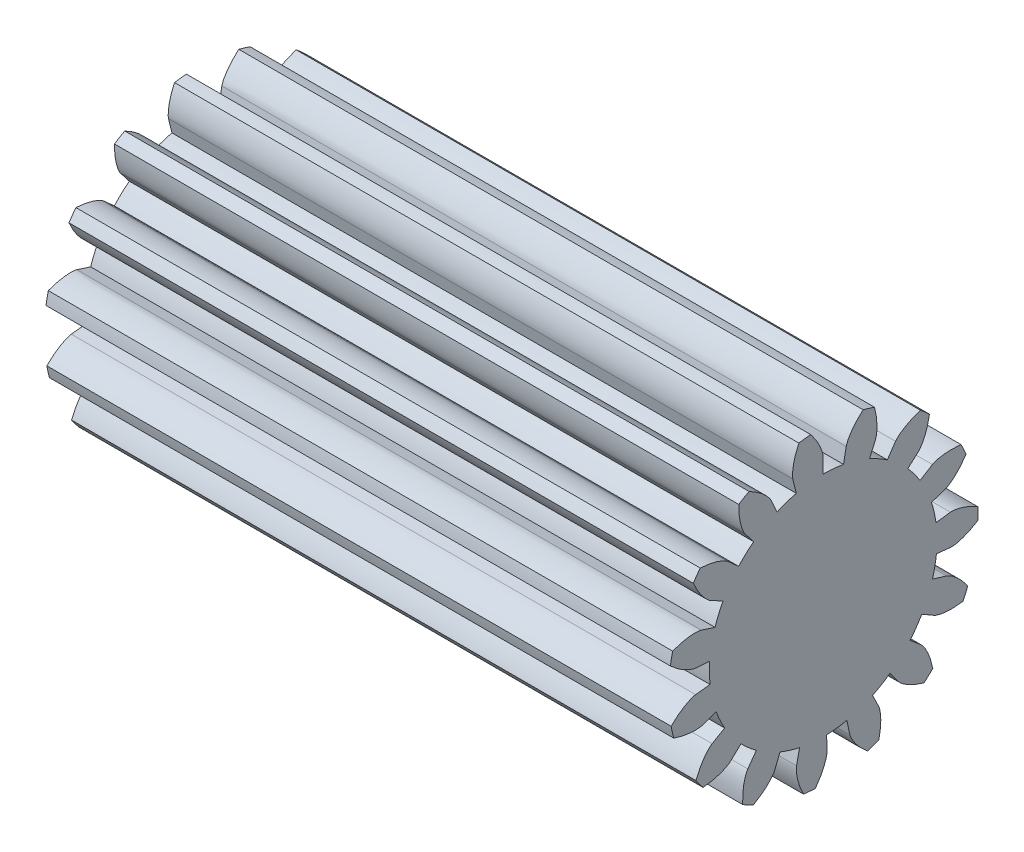
from build123d import *

# Parameters (mm, degrees)
SKETCH1_R                 = 2.833333333
BOSS_EXTRUDE1_DEPTH       = 11.43
CUT_EXTRUDE1_DEPTH        = 13.111996349
CIRPATTERN6_COUNT         = 15
CIRPATTERN6_COPY_1_DEPTH  = 13.111996349
CIRPATTERN6_COPY_2_DEPTH  = 13.111996349
CIRPATTERN6_COPY_3_DEPTH  = 13.111996349
CIRPATTERN6_COPY_4_DEPTH  = 13.111996349
CIRPATTERN6_COPY_5_DEPTH  = 13.111996349
CIRPATTERN6_COPY_6_DEPTH  = 13.111996349
CIRPATTERN6_COPY_7_DEPTH  = 13.111996349
CIRPATTERN6_COPY_8_DEPTH  = 13.111996349
CIRPATTERN6_COPY_9_DEPTH  = 13.111996349
CIRPATTERN6_COPY_10_DEPTH = 13.111996349
CIRPATTERN6_COPY_11_DEPTH = 13.111996349
CIRPATTERN6_COPY_12_DEPTH = 13.111996349
CIRPATTERN6_COPY_13_DEPTH = 13.111996349
CIRPATTERN6_COPY_14_DEPTH = 13.111996349


with BuildPart() as part:
    # Sketch1 → Boss-Extrude1 (new body)
    with BuildSketch(Plane.YZ):
        with Locations(Location((0, 0, 0), (0, 0, 270))):
            Circle(SKETCH1_R)
    extrude(amount=BOSS_EXTRUDE1_DEPTH)

    # Sketch3 → Cut-Extrude1 (cut, through all)
    with BuildSketch(Plane.YZ.offset(11.43)):
        with BuildLine():
            Line((2.489923292, -0.224236484), (2.339762544, -0.210713369))
            Line((2.339762544, -0.210713369), (2.074936077, -0.186863736))
            ThreePointArc((2.074936077, -0.186863736), (2.08123296, -0.093526159), (2.083333333, 0))
            Line((2.083333333, 0), (2.349231552, 0))
            add(Edge.make_bspline(
                [(2.349231552, 0), (2.350968346, 3.6754e-05), (2.355835834, 0.000253578), (2.370835553, 0.001656605), (2.400223443, 0.006481364), (2.436045096, 0.01536564), (2.476603798, 0.02833644), (2.515144563, 0.042994594), (2.547681354, 0.056840209), (2.579712966, 0.071857897), (2.611212746, 0.08789641), (2.648845828, 0.108578302), (2.693217496, 0.135111207), (2.743878144, 0.168588781), (2.799834182, 0.209423625), (2.855116098, 0.254005099), (2.908031101, 0.300280352), (2.959660854, 0.349692585), (3.008304545, 0.399380199), (3.056798276, 0.453569941), (3.100536534, 0.504916857), (3.147154604, 0.565154644), (3.184090219, 0.614573387), (3.220170862, 0.667780974), (3.237421449, 0.693990491), (3.246105412, 0.707514963)],
                knots=[0, 0, 0, 0, 0, 0.005376748, 0.015083688, 0.046610139, 0.092110525, 0.119476175, 0.146842495, 0.174208853, 0.201574955, 0.228941013, 0.256307345, 0.307035032, 0.361767351, 0.41649966, 0.471231936, 0.525964281, 0.580696615, 0.635428982, 0.690161387, 0.744893688, 0.799626083, 0.854358408, 0.909090916, 0.909090916, 0.909090916, 0.909090916, 0.909090916], degree=4))
            Line((3.246105412, 0.707514963), (3.246105412, -0.292336421))
            Line((3.246105412, -0.292336421), (2.489923292, -0.224236484))
        make_face()
    cut_extrude1 = extrude(amount=-CUT_EXTRUDE1_DEPTH, mode=Mode.SUBTRACT)

    # Mirror1: Cut-Extrude1 across plane
    add(cut_extrude1.mirror(Plane(origin=(0, 2.489923292, -0.224236484), x_dir=(1, 0, 0), z_dir=(0, -0.08969459343223997, -0.9959693167507849))), mode=Mode.SUBTRACT)

    # CirPattern6: Cut-Extrude1 ×15 about axis
    cirpattern6_axis = Axis((11.43, 0, 0), (-1, 0, 0))
    for i in range(1, CIRPATTERN6_COUNT):
        add(cut_extrude1.rotate(cirpattern6_axis, i * 360 / CIRPATTERN6_COUNT), mode=Mode.SUBTRACT)

    # CirPattern6 copy 1 sketch → CirPattern6 copy 1 (cut, through all)
    with BuildSketch(Plane(origin=(11.43, 0, 0), x_dir=(0, 0.8261762315426959, -0.5634117805246086), z_dir=(1, 0, 0))):
        with BuildLine():
            Line((2.489923292, 0.224236484), (2.339762544, 0.210713369))
            Line((2.339762544, 0.210713369), (2.074936077, 0.186863736))
            ThreePointArc((2.074936077, 0.186863736), (2.08123296, 0.093526159), (2.083333333, 0))
            Line((2.083333333, 0), (2.349231552, 0))
            add(Edge.make_bspline(
                [(2.349231552, 0), (2.350968346, -3.6754e-05), (2.355835834, -0.000253578), (2.370835553, -0.001656605), (2.400223443, -0.006481364), (2.436045096, -0.01536564), (2.476603798, -0.02833644), (2.515144563, -0.042994594), (2.547681354, -0.056840209), (2.579712966, -0.071857897), (2.611212746, -0.08789641), (2.648845828, -0.108578302), (2.693217496, -0.135111207), (2.743878144, -0.168588781), (2.799834182, -0.209423625), (2.855116098, -0.254005099), (2.908031101, -0.300280352), (2.959660854, -0.349692585), (3.008304545, -0.399380199), (3.056798276, -0.453569941), (3.100536534, -0.504916857), (3.147154604, -0.565154644), (3.184090219, -0.614573387), (3.220170862, -0.667780974), (3.237421449, -0.693990491), (3.246105412, -0.707514963)],
                knots=[0, 0, 0, 0, 0, 0.005376748, 0.015083688, 0.046610139, 0.092110525, 0.119476175, 0.146842495, 0.174208853, 0.201574955, 0.228941013, 0.256307345, 0.307035032, 0.361767351, 0.41649966, 0.471231936, 0.525964281, 0.580696615, 0.635428982, 0.690161387, 0.744893688, 0.799626083, 0.854358408, 0.909090916, 0.909090916, 0.909090916, 0.909090916, 0.909090916], degree=4))
            Line((3.246105412, -0.707514963), (3.246105412, 0.292336421))
            Line((3.246105412, 0.292336421), (2.489923292, 0.224236484))
        make_face()
    extrude(amount=-CIRPATTERN6_COPY_1_DEPTH, mode=Mode.SUBTRACT)

    # CirPattern6 copy 2 sketch → CirPattern6 copy 2 (cut, through all)
    with BuildSketch(Plane(origin=(11.43, 0, 0), x_dir=(0, 0.5255893272581728, -0.8507384198872774), z_dir=(1, 0, 0))):
        with BuildLine():
            Line((2.489923292, 0.224236484), (2.339762544, 0.210713369))
            Line((2.339762544, 0.210713369), (2.074936077, 0.186863736))
            ThreePointArc((2.074936077, 0.186863736), (2.08123296, 0.093526159), (2.083333333, 0))
            Line((2.083333333, 0), (2.349231552, 0))
            add(Edge.make_bspline(
                [(2.349231552, 0), (2.350968346, -3.6754e-05), (2.355835834, -0.000253578), (2.370835553, -0.001656605), (2.400223443, -0.006481364), (2.436045096, -0.01536564), (2.476603798, -0.02833644), (2.515144563, -0.042994594), (2.547681354, -0.056840209), (2.579712966, -0.071857897), (2.611212746, -0.08789641), (2.648845828, -0.108578302), (2.693217496, -0.135111207), (2.743878144, -0.168588781), (2.799834182, -0.209423625), (2.855116098, -0.254005099), (2.908031101, -0.300280352), (2.959660854, -0.349692585), (3.008304545, -0.399380199), (3.056798276, -0.453569941), (3.100536534, -0.504916857), (3.147154604, -0.565154644), (3.184090219, -0.614573387), (3.220170862, -0.667780974), (3.237421449, -0.693990491), (3.246105412, -0.707514963)],
                knots=[0, 0, 0, 0, 0, 0.005376748, 0.015083688, 0.046610139, 0.092110525, 0.119476175, 0.146842495, 0.174208853, 0.201574955, 0.228941013, 0.256307345, 0.307035032, 0.361767351, 0.41649966, 0.471231936, 0.525964281, 0.580696615, 0.635428982, 0.690161387, 0.744893688, 0.799626083, 0.854358408, 0.909090916, 0.909090916, 0.909090916, 0.909090916, 0.909090916], degree=4))
            Line((3.246105412, -0.707514963), (3.246105412, 0.292336421))
            Line((3.246105412, 0.292336421), (2.489923292, 0.224236484))
        make_face()
    extrude(amount=-CIRPATTERN6_COPY_2_DEPTH, mode=Mode.SUBTRACT)

    # CirPattern6 copy 3 sketch → CirPattern6 copy 3 (cut, through all)
    with BuildSketch(Plane(origin=(11.43, 0, 0), x_dir=(0, 0.13412325346157242, -0.9909646577355233), z_dir=(1, 0, 0))):
        with BuildLine():
            Line((2.489923292, 0.224236484), (2.339762544, 0.210713369))
            Line((2.339762544, 0.210713369), (2.074936077, 0.186863736))
            ThreePointArc((2.074936077, 0.186863736), (2.08123296, 0.093526159), (2.083333333, 0))
            Line((2.083333333, 0), (2.349231552, 0))
            add(Edge.make_bspline(
                [(2.349231552, 0), (2.350968346, -3.6754e-05), (2.355835834, -0.000253578), (2.370835553, -0.001656605), (2.400223443, -0.006481364), (2.436045096, -0.01536564), (2.476603798, -0.02833644), (2.515144563, -0.042994594), (2.547681354, -0.056840209), (2.579712966, -0.071857897), (2.611212746, -0.08789641), (2.648845828, -0.108578302), (2.693217496, -0.135111207), (2.743878144, -0.168588781), (2.799834182, -0.209423625), (2.855116098, -0.254005099), (2.908031101, -0.300280352), (2.959660854, -0.349692585), (3.008304545, -0.399380199), (3.056798276, -0.453569941), (3.100536534, -0.504916857), (3.147154604, -0.565154644), (3.184090219, -0.614573387), (3.220170862, -0.667780974), (3.237421449, -0.693990491), (3.246105412, -0.707514963)],
                knots=[0, 0, 0, 0, 0, 0.005376748, 0.015083688, 0.046610139, 0.092110525, 0.119476175, 0.146842495, 0.174208853, 0.201574955, 0.228941013, 0.256307345, 0.307035032, 0.361767351, 0.41649966, 0.471231936, 0.525964281, 0.580696615, 0.635428982, 0.690161387, 0.744893688, 0.799626083, 0.854358408, 0.909090916, 0.909090916, 0.909090916, 0.909090916, 0.909090916], degree=4))
            Line((3.246105412, -0.707514963), (3.246105412, 0.292336421))
            Line((3.246105412, 0.292336421), (2.489923292, 0.224236484))
        make_face()
    extrude(amount=-CIRPATTERN6_COPY_3_DEPTH, mode=Mode.SUBTRACT)

    # CirPattern6 copy 4 sketch → CirPattern6 copy 4 (cut, through all)
    with BuildSketch(Plane(origin=(11.43, 0, 0), x_dir=(0, -0.2805339493300394, -0.9598441036300067), z_dir=(1, 0, 0))):
        with BuildLine():
            Line((2.489923292, 0.224236484), (2.339762544, 0.210713369))
            Line((2.339762544, 0.210713369), (2.074936077, 0.186863736))
            ThreePointArc((2.074936077, 0.186863736), (2.08123296, 0.093526159), (2.083333333, 0))
            Line((2.083333333, 0), (2.349231552, 0))
            add(Edge.make_bspline(
                [(2.349231552, 0), (2.350968346, -3.6754e-05), (2.355835834, -0.000253578), (2.370835553, -0.001656605), (2.400223443, -0.006481364), (2.436045096, -0.01536564), (2.476603798, -0.02833644), (2.515144563, -0.042994594), (2.547681354, -0.056840209), (2.579712966, -0.071857897), (2.611212746, -0.08789641), (2.648845828, -0.108578302), (2.693217496, -0.135111207), (2.743878144, -0.168588781), (2.799834182, -0.209423625), (2.855116098, -0.254005099), (2.908031101, -0.300280352), (2.959660854, -0.349692585), (3.008304545, -0.399380199), (3.056798276, -0.453569941), (3.100536534, -0.504916857), (3.147154604, -0.565154644), (3.184090219, -0.614573387), (3.220170862, -0.667780974), (3.237421449, -0.693990491), (3.246105412, -0.707514963)],
                knots=[0, 0, 0, 0, 0, 0.005376748, 0.015083688, 0.046610139, 0.092110525, 0.119476175, 0.146842495, 0.174208853, 0.201574955, 0.228941013, 0.256307345, 0.307035032, 0.361767351, 0.41649966, 0.471231936, 0.525964281, 0.580696615, 0.635428982, 0.690161387, 0.744893688, 0.799626083, 0.854358408, 0.909090916, 0.909090916, 0.909090916, 0.909090916, 0.909090916], degree=4))
            Line((3.246105412, -0.707514963), (3.246105412, 0.292336421))
            Line((3.246105412, 0.292336421), (2.489923292, 0.224236484))
        make_face()
    extrude(amount=-CIRPATTERN6_COPY_4_DEPTH, mode=Mode.SUBTRACT)

    # CirPattern6 copy 5 sketch → CirPattern6 copy 5 (cut, through all)
    with BuildSketch(Plane(origin=(11.43, 0, 0), x_dir=(0, -0.6466842837115663, -0.7627577840969297), z_dir=(1, 0, 0))):
        with BuildLine():
            Line((2.489923292, 0.224236484), (2.339762544, 0.210713369))
            Line((2.339762544, 0.210713369), (2.074936077, 0.186863736))
            ThreePointArc((2.074936077, 0.186863736), (2.08123296, 0.093526159), (2.083333333, 0))
            Line((2.083333333, 0), (2.349231552, 0))
            add(Edge.make_bspline(
                [(2.349231552, 0), (2.350968346, -3.6754e-05), (2.355835834, -0.000253578), (2.370835553, -0.001656605), (2.400223443, -0.006481364), (2.436045096, -0.01536564), (2.476603798, -0.02833644), (2.515144563, -0.042994594), (2.547681354, -0.056840209), (2.579712966, -0.071857897), (2.611212746, -0.08789641), (2.648845828, -0.108578302), (2.693217496, -0.135111207), (2.743878144, -0.168588781), (2.799834182, -0.209423625), (2.855116098, -0.254005099), (2.908031101, -0.300280352), (2.959660854, -0.349692585), (3.008304545, -0.399380199), (3.056798276, -0.453569941), (3.100536534, -0.504916857), (3.147154604, -0.565154644), (3.184090219, -0.614573387), (3.220170862, -0.667780974), (3.237421449, -0.693990491), (3.246105412, -0.707514963)],
                knots=[0, 0, 0, 0, 0, 0.005376748, 0.015083688, 0.046610139, 0.092110525, 0.119476175, 0.146842495, 0.174208853, 0.201574955, 0.228941013, 0.256307345, 0.307035032, 0.361767351, 0.41649966, 0.471231936, 0.525964281, 0.580696615, 0.635428982, 0.690161387, 0.744893688, 0.799626083, 0.854358408, 0.909090916, 0.909090916, 0.909090916, 0.909090916, 0.909090916], degree=4))
            Line((3.246105412, -0.707514963), (3.246105412, 0.292336421))
            Line((3.246105412, 0.292336421), (2.489923292, 0.224236484))
        make_face()
    extrude(amount=-CIRPATTERN6_COPY_5_DEPTH, mode=Mode.SUBTRACT)

    # CirPattern6 copy 6 sketch → CirPattern6 copy 6 (cut, through all)
    with BuildSketch(Plane(origin=(11.43, 0, 0), x_dir=(0, -0.9010170304970816, -0.43378371425656503), z_dir=(1, 0, 0))):
        with BuildLine():
            Line((2.489923292, 0.224236484), (2.339762544, 0.210713369))
            Line((2.339762544, 0.210713369), (2.074936077, 0.186863736))
            ThreePointArc((2.074936077, 0.186863736), (2.08123296, 0.093526159), (2.083333333, 0))
            Line((2.083333333, 0), (2.349231552, 0))
            add(Edge.make_bspline(
                [(2.349231552, 0), (2.350968346, -3.6754e-05), (2.355835834, -0.000253578), (2.370835553, -0.001656605), (2.400223443, -0.006481364), (2.436045096, -0.01536564), (2.476603798, -0.02833644), (2.515144563, -0.042994594), (2.547681354, -0.056840209), (2.579712966, -0.071857897), (2.611212746, -0.08789641), (2.648845828, -0.108578302), (2.693217496, -0.135111207), (2.743878144, -0.168588781), (2.799834182, -0.209423625), (2.855116098, -0.254005099), (2.908031101, -0.300280352), (2.959660854, -0.349692585), (3.008304545, -0.399380199), (3.056798276, -0.453569941), (3.100536534, -0.504916857), (3.147154604, -0.565154644), (3.184090219, -0.614573387), (3.220170862, -0.667780974), (3.237421449, -0.693990491), (3.246105412, -0.707514963)],
                knots=[0, 0, 0, 0, 0, 0.005376748, 0.015083688, 0.046610139, 0.092110525, 0.119476175, 0.146842495, 0.174208853, 0.201574955, 0.228941013, 0.256307345, 0.307035032, 0.361767351, 0.41649966, 0.471231936, 0.525964281, 0.580696615, 0.635428982, 0.690161387, 0.744893688, 0.799626083, 0.854358408, 0.909090916, 0.909090916, 0.909090916, 0.909090916, 0.909090916], degree=4))
            Line((3.246105412, -0.707514963), (3.246105412, 0.292336421))
            Line((3.246105412, 0.292336421), (2.489923292, 0.224236484))
        make_face()
    extrude(amount=-CIRPATTERN6_COPY_6_DEPTH, mode=Mode.SUBTRACT)

    # CirPattern6 copy 7 sketch → CirPattern6 copy 7 (cut, through all)
    with BuildSketch(Plane(origin=(11.43, 0, 0), x_dir=(0, -0.9995557472269011, -0.02980449941991184), z_dir=(1, 0, 0))):
        with BuildLine():
            Line((2.489923292, 0.224236484), (2.339762544, 0.210713369))
            Line((2.339762544, 0.210713369), (2.074936077, 0.186863736))
            ThreePointArc((2.074936077, 0.186863736), (2.08123296, 0.093526159), (2.083333333, 0))
            Line((2.083333333, 0), (2.349231552, 0))
            add(Edge.make_bspline(
                [(2.349231552, 0), (2.350968346, -3.6754e-05), (2.355835834, -0.000253578), (2.370835553, -0.001656605), (2.400223443, -0.006481364), (2.436045096, -0.01536564), (2.476603798, -0.02833644), (2.515144563, -0.042994594), (2.547681354, -0.056840209), (2.579712966, -0.071857897), (2.611212746, -0.08789641), (2.648845828, -0.108578302), (2.693217496, -0.135111207), (2.743878144, -0.168588781), (2.799834182, -0.209423625), (2.855116098, -0.254005099), (2.908031101, -0.300280352), (2.959660854, -0.349692585), (3.008304545, -0.399380199), (3.056798276, -0.453569941), (3.100536534, -0.504916857), (3.147154604, -0.565154644), (3.184090219, -0.614573387), (3.220170862, -0.667780974), (3.237421449, -0.693990491), (3.246105412, -0.707514963)],
                knots=[0, 0, 0, 0, 0, 0.005376748, 0.015083688, 0.046610139, 0.092110525, 0.119476175, 0.146842495, 0.174208853, 0.201574955, 0.228941013, 0.256307345, 0.307035032, 0.361767351, 0.41649966, 0.471231936, 0.525964281, 0.580696615, 0.635428982, 0.690161387, 0.744893688, 0.799626083, 0.854358408, 0.909090916, 0.909090916, 0.909090916, 0.909090916, 0.909090916], degree=4))
            Line((3.246105412, -0.707514963), (3.246105412, 0.292336421))
            Line((3.246105412, 0.292336421), (2.489923292, 0.224236484))
        make_face()
    extrude(amount=-CIRPATTERN6_COPY_7_DEPTH, mode=Mode.SUBTRACT)

    # CirPattern6 copy 8 sketch → CirPattern6 copy 8 (cut, through all)
    with BuildSketch(Plane(origin=(11.43, 0, 0), x_dir=(0, -0.9252621945823007, 0.379328184131821), z_dir=(1, 0, 0))):
        with BuildLine():
            Line((2.489923292, 0.224236484), (2.339762544, 0.210713369))
            Line((2.339762544, 0.210713369), (2.074936077, 0.186863736))
            ThreePointArc((2.074936077, 0.186863736), (2.08123296, 0.093526159), (2.083333333, 0))
            Line((2.083333333, 0), (2.349231552, 0))
            add(Edge.make_bspline(
                [(2.349231552, 0), (2.350968346, -3.6754e-05), (2.355835834, -0.000253578), (2.370835553, -0.001656605), (2.400223443, -0.006481364), (2.436045096, -0.01536564), (2.476603798, -0.02833644), (2.515144563, -0.042994594), (2.547681354, -0.056840209), (2.579712966, -0.071857897), (2.611212746, -0.08789641), (2.648845828, -0.108578302), (2.693217496, -0.135111207), (2.743878144, -0.168588781), (2.799834182, -0.209423625), (2.855116098, -0.254005099), (2.908031101, -0.300280352), (2.959660854, -0.349692585), (3.008304545, -0.399380199), (3.056798276, -0.453569941), (3.100536534, -0.504916857), (3.147154604, -0.565154644), (3.184090219, -0.614573387), (3.220170862, -0.667780974), (3.237421449, -0.693990491), (3.246105412, -0.707514963)],
                knots=[0, 0, 0, 0, 0, 0.005376748, 0.015083688, 0.046610139, 0.092110525, 0.119476175, 0.146842495, 0.174208853, 0.201574955, 0.228941013, 0.256307345, 0.307035032, 0.361767351, 0.41649966, 0.471231936, 0.525964281, 0.580696615, 0.635428982, 0.690161387, 0.744893688, 0.799626083, 0.854358408, 0.909090916, 0.909090916, 0.909090916, 0.909090916, 0.909090916], degree=4))
            Line((3.246105412, -0.707514963), (3.246105412, 0.292336421))
            Line((3.246105412, 0.292336421), (2.489923292, 0.224236484))
        make_face()
    extrude(amount=-CIRPATTERN6_COPY_8_DEPTH, mode=Mode.SUBTRACT)

    # CirPattern6 copy 9 sketch → CirPattern6 copy 9 (cut, through all)
    with BuildSketch(Plane(origin=(11.43, 0, 0), x_dir=(0, -0.6909824027512695, 0.7228715785587938), z_dir=(1, 0, 0))):
        with BuildLine():
            Line((2.489923292, 0.224236484), (2.339762544, 0.210713369))
            Line((2.339762544, 0.210713369), (2.074936077, 0.186863736))
            ThreePointArc((2.074936077, 0.186863736), (2.08123296, 0.093526159), (2.083333333, 0))
            Line((2.083333333, 0), (2.349231552, 0))
            add(Edge.make_bspline(
                [(2.349231552, 0), (2.350968346, -3.6754e-05), (2.355835834, -0.000253578), (2.370835553, -0.001656605), (2.400223443, -0.006481364), (2.436045096, -0.01536564), (2.476603798, -0.02833644), (2.515144563, -0.042994594), (2.547681354, -0.056840209), (2.579712966, -0.071857897), (2.611212746, -0.08789641), (2.648845828, -0.108578302), (2.693217496, -0.135111207), (2.743878144, -0.168588781), (2.799834182, -0.209423625), (2.855116098, -0.254005099), (2.908031101, -0.300280352), (2.959660854, -0.349692585), (3.008304545, -0.399380199), (3.056798276, -0.453569941), (3.100536534, -0.504916857), (3.147154604, -0.565154644), (3.184090219, -0.614573387), (3.220170862, -0.667780974), (3.237421449, -0.693990491), (3.246105412, -0.707514963)],
                knots=[0, 0, 0, 0, 0, 0.005376748, 0.015083688, 0.046610139, 0.092110525, 0.119476175, 0.146842495, 0.174208853, 0.201574955, 0.228941013, 0.256307345, 0.307035032, 0.361767351, 0.41649966, 0.471231936, 0.525964281, 0.580696615, 0.635428982, 0.690161387, 0.744893688, 0.799626083, 0.854358408, 0.909090916, 0.909090916, 0.909090916, 0.909090916, 0.909090916], degree=4))
            Line((3.246105412, -0.707514963), (3.246105412, 0.292336421))
            Line((3.246105412, 0.292336421), (2.489923292, 0.224236484))
        make_face()
    extrude(amount=-CIRPATTERN6_COPY_9_DEPTH, mode=Mode.SUBTRACT)

    # CirPattern6 copy 10 sketch → CirPattern6 copy 10 (cut, through all)
    with BuildSketch(Plane(origin=(11.43, 0, 0), x_dir=(0, -0.33722547610648446, 0.9414239099708244), z_dir=(1, 0, 0))):
        with BuildLine():
            Line((2.489923292, 0.224236484), (2.339762544, 0.210713369))
            Line((2.339762544, 0.210713369), (2.074936077, 0.186863736))
            ThreePointArc((2.074936077, 0.186863736), (2.08123296, 0.093526159), (2.083333333, 0))
            Line((2.083333333, 0), (2.349231552, 0))
            add(Edge.make_bspline(
                [(2.349231552, 0), (2.350968346, -3.6754e-05), (2.355835834, -0.000253578), (2.370835553, -0.001656605), (2.400223443, -0.006481364), (2.436045096, -0.01536564), (2.476603798, -0.02833644), (2.515144563, -0.042994594), (2.547681354, -0.056840209), (2.579712966, -0.071857897), (2.611212746, -0.08789641), (2.648845828, -0.108578302), (2.693217496, -0.135111207), (2.743878144, -0.168588781), (2.799834182, -0.209423625), (2.855116098, -0.254005099), (2.908031101, -0.300280352), (2.959660854, -0.349692585), (3.008304545, -0.399380199), (3.056798276, -0.453569941), (3.100536534, -0.504916857), (3.147154604, -0.565154644), (3.184090219, -0.614573387), (3.220170862, -0.667780974), (3.237421449, -0.693990491), (3.246105412, -0.707514963)],
                knots=[0, 0, 0, 0, 0, 0.005376748, 0.015083688, 0.046610139, 0.092110525, 0.119476175, 0.146842495, 0.174208853, 0.201574955, 0.228941013, 0.256307345, 0.307035032, 0.361767351, 0.41649966, 0.471231936, 0.525964281, 0.580696615, 0.635428982, 0.690161387, 0.744893688, 0.799626083, 0.854358408, 0.909090916, 0.909090916, 0.909090916, 0.909090916, 0.909090916], degree=4))
            Line((3.246105412, -0.707514963), (3.246105412, 0.292336421))
            Line((3.246105412, 0.292336421), (2.489923292, 0.224236484))
        make_face()
    extrude(amount=-CIRPATTERN6_COPY_10_DEPTH, mode=Mode.SUBTRACT)

    # CirPattern6 copy 11 sketch → CirPattern6 copy 11 (cut, through all)
    with BuildSketch(Plane(origin=(11.43, 0, 0), x_dir=(0, 0.0748407989543858, 0.9971954947811735), z_dir=(1, 0, 0))):
        with BuildLine():
            Line((2.489923292, 0.224236484), (2.339762544, 0.210713369))
            Line((2.339762544, 0.210713369), (2.074936077, 0.186863736))
            ThreePointArc((2.074936077, 0.186863736), (2.08123296, 0.093526159), (2.083333333, 0))
            Line((2.083333333, 0), (2.349231552, 0))
            add(Edge.make_bspline(
                [(2.349231552, 0), (2.350968346, -3.6754e-05), (2.355835834, -0.000253578), (2.370835553, -0.001656605), (2.400223443, -0.006481364), (2.436045096, -0.01536564), (2.476603798, -0.02833644), (2.515144563, -0.042994594), (2.547681354, -0.056840209), (2.579712966, -0.071857897), (2.611212746, -0.08789641), (2.648845828, -0.108578302), (2.693217496, -0.135111207), (2.743878144, -0.168588781), (2.799834182, -0.209423625), (2.855116098, -0.254005099), (2.908031101, -0.300280352), (2.959660854, -0.349692585), (3.008304545, -0.399380199), (3.056798276, -0.453569941), (3.100536534, -0.504916857), (3.147154604, -0.565154644), (3.184090219, -0.614573387), (3.220170862, -0.667780974), (3.237421449, -0.693990491), (3.246105412, -0.707514963)],
                knots=[0, 0, 0, 0, 0, 0.005376748, 0.015083688, 0.046610139, 0.092110525, 0.119476175, 0.146842495, 0.174208853, 0.201574955, 0.228941013, 0.256307345, 0.307035032, 0.361767351, 0.41649966, 0.471231936, 0.525964281, 0.580696615, 0.635428982, 0.690161387, 0.744893688, 0.799626083, 0.854358408, 0.909090916, 0.909090916, 0.909090916, 0.909090916, 0.909090916], degree=4))
            Line((3.246105412, -0.707514963), (3.246105412, 0.292336421))
            Line((3.246105412, 0.292336421), (2.489923292, 0.224236484))
        make_face()
    extrude(amount=-CIRPATTERN6_COPY_11_DEPTH, mode=Mode.SUBTRACT)

    # CirPattern6 copy 12 sketch → CirPattern6 copy 12 (cut, through all)
    with BuildSketch(Plane(origin=(11.43, 0, 0), x_dir=(0, 0.4739664199687281, 0.8805429193071894), z_dir=(1, 0, 0))):
        with BuildLine():
            Line((2.489923292, 0.224236484), (2.339762544, 0.210713369))
            Line((2.339762544, 0.210713369), (2.074936077, 0.186863736))
            ThreePointArc((2.074936077, 0.186863736), (2.08123296, 0.093526159), (2.083333333, 0))
            Line((2.083333333, 0), (2.349231552, 0))
            add(Edge.make_bspline(
                [(2.349231552, 0), (2.350968346, -3.6754e-05), (2.355835834, -0.000253578), (2.370835553, -0.001656605), (2.400223443, -0.006481364), (2.436045096, -0.01536564), (2.476603798, -0.02833644), (2.515144563, -0.042994594), (2.547681354, -0.056840209), (2.579712966, -0.071857897), (2.611212746, -0.08789641), (2.648845828, -0.108578302), (2.693217496, -0.135111207), (2.743878144, -0.168588781), (2.799834182, -0.209423625), (2.855116098, -0.254005099), (2.908031101, -0.300280352), (2.959660854, -0.349692585), (3.008304545, -0.399380199), (3.056798276, -0.453569941), (3.100536534, -0.504916857), (3.147154604, -0.565154644), (3.184090219, -0.614573387), (3.220170862, -0.667780974), (3.237421449, -0.693990491), (3.246105412, -0.707514963)],
                knots=[0, 0, 0, 0, 0, 0.005376748, 0.015083688, 0.046610139, 0.092110525, 0.119476175, 0.146842495, 0.174208853, 0.201574955, 0.228941013, 0.256307345, 0.307035032, 0.361767351, 0.41649966, 0.471231936, 0.525964281, 0.580696615, 0.635428982, 0.690161387, 0.744893688, 0.799626083, 0.854358408, 0.909090916, 0.909090916, 0.909090916, 0.909090916, 0.909090916], degree=4))
            Line((3.246105412, -0.707514963), (3.246105412, 0.292336421))
            Line((3.246105412, 0.292336421), (2.489923292, 0.224236484))
        make_face()
    extrude(amount=-CIRPATTERN6_COPY_12_DEPTH, mode=Mode.SUBTRACT)

    # CirPattern6 copy 13 sketch → CirPattern6 copy 13 (cut, through all)
    with BuildSketch(Plane(origin=(11.43, 0, 0), x_dir=(0, 0.791138941120728, 0.611636473603703), z_dir=(1, 0, 0))):
        with BuildLine():
            Line((2.489923292, 0.224236484), (2.339762544, 0.210713369))
            Line((2.339762544, 0.210713369), (2.074936077, 0.186863736))
            ThreePointArc((2.074936077, 0.186863736), (2.08123296, 0.093526159), (2.083333333, 0))
            Line((2.083333333, 0), (2.349231552, 0))
            add(Edge.make_bspline(
                [(2.349231552, 0), (2.350968346, -3.6754e-05), (2.355835834, -0.000253578), (2.370835553, -0.001656605), (2.400223443, -0.006481364), (2.436045096, -0.01536564), (2.476603798, -0.02833644), (2.515144563, -0.042994594), (2.547681354, -0.056840209), (2.579712966, -0.071857897), (2.611212746, -0.08789641), (2.648845828, -0.108578302), (2.693217496, -0.135111207), (2.743878144, -0.168588781), (2.799834182, -0.209423625), (2.855116098, -0.254005099), (2.908031101, -0.300280352), (2.959660854, -0.349692585), (3.008304545, -0.399380199), (3.056798276, -0.453569941), (3.100536534, -0.504916857), (3.147154604, -0.565154644), (3.184090219, -0.614573387), (3.220170862, -0.667780974), (3.237421449, -0.693990491), (3.246105412, -0.707514963)],
                knots=[0, 0, 0, 0, 0, 0.005376748, 0.015083688, 0.046610139, 0.092110525, 0.119476175, 0.146842495, 0.174208853, 0.201574955, 0.228941013, 0.256307345, 0.307035032, 0.361767351, 0.41649966, 0.471231936, 0.525964281, 0.580696615, 0.635428982, 0.690161387, 0.744893688, 0.799626083, 0.854358408, 0.909090916, 0.909090916, 0.909090916, 0.909090916, 0.909090916], degree=4))
            Line((3.246105412, -0.707514963), (3.246105412, 0.292336421))
            Line((3.246105412, 0.292336421), (2.489923292, 0.224236484))
        make_face()
    extrude(amount=-CIRPATTERN6_COPY_13_DEPTH, mode=Mode.SUBTRACT)

    # CirPattern6 copy 14 sketch → CirPattern6 copy 14 (cut, through all)
    with BuildSketch(Plane(origin=(11.43, 0, 0), x_dir=(0, 0.9715163520813089, 0.23697252507121266), z_dir=(1, 0, 0))):
        with BuildLine():
            Line((2.489923292, 0.224236484), (2.339762544, 0.210713369))
            Line((2.339762544, 0.210713369), (2.074936077, 0.186863736))
            ThreePointArc((2.074936077, 0.186863736), (2.08123296, 0.093526159), (2.083333333, 0))
            Line((2.083333333, 0), (2.349231552, 0))
            add(Edge.make_bspline(
                [(2.349231552, 0), (2.350968346, -3.6754e-05), (2.355835834, -0.000253578), (2.370835553, -0.001656605), (2.400223443, -0.006481364), (2.436045096, -0.01536564), (2.476603798, -0.02833644), (2.515144563, -0.042994594), (2.547681354, -0.056840209), (2.579712966, -0.071857897), (2.611212746, -0.08789641), (2.648845828, -0.108578302), (2.693217496, -0.135111207), (2.743878144, -0.168588781), (2.799834182, -0.209423625), (2.855116098, -0.254005099), (2.908031101, -0.300280352), (2.959660854, -0.349692585), (3.008304545, -0.399380199), (3.056798276, -0.453569941), (3.100536534, -0.504916857), (3.147154604, -0.565154644), (3.184090219, -0.614573387), (3.220170862, -0.667780974), (3.237421449, -0.693990491), (3.246105412, -0.707514963)],
                knots=[0, 0, 0, 0, 0, 0.005376748, 0.015083688, 0.046610139, 0.092110525, 0.119476175, 0.146842495, 0.174208853, 0.201574955, 0.228941013, 0.256307345, 0.307035032, 0.361767351, 0.41649966, 0.471231936, 0.525964281, 0.580696615, 0.635428982, 0.690161387, 0.744893688, 0.799626083, 0.854358408, 0.909090916, 0.909090916, 0.909090916, 0.909090916, 0.909090916], degree=4))
            Line((3.246105412, -0.707514963), (3.246105412, 0.292336421))
            Line((3.246105412, 0.292336421), (2.489923292, 0.224236484))
        make_face()
    extrude(amount=-CIRPATTERN6_COPY_14_DEPTH, mode=Mode.SUBTRACT)


solid = part.part
